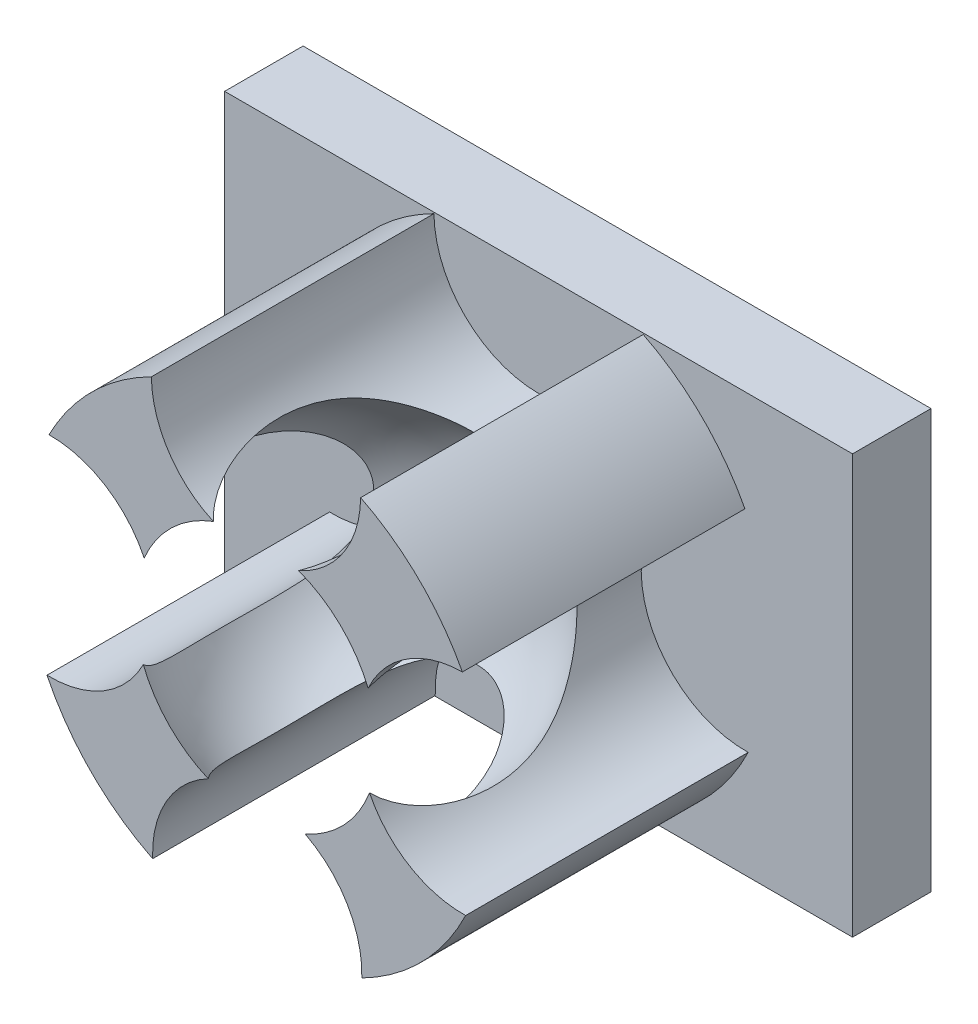
from build123d import *

# Parameters (mm, degrees)
SKIZZE1_W                       = 24
SKIZZE1_H                       = 16
AUFSATZ_LINEAR_AUSTRAGEN1_DEPTH = 3
AUFSATZ_LINEAR_AUSTRAGEN2_DEPTH = 10.8


with BuildPart() as part:
    # Skizze1 → Aufsatz-Linear austragen1 (new body)
    with BuildSketch(Plane.XY):
        Rectangle(SKIZZE1_W, SKIZZE1_H)
    extrude(amount=AUFSATZ_LINEAR_AUSTRAGEN1_DEPTH)

    # Skizze2 → Aufsatz-Linear austragen2 (add)
    with BuildSketch(Plane.XY.offset(3)):
        with BuildLine():
            ThreePointArc((-3.999695252, 7.950625), (-6.26249607, 6.323855072), (-7.911250653, 4.077022578))
            ThreePointArc((-7.911250653, 4.077022578), (-3.876728126, 0.037983649), (-7.989616413, -3.92122807))
            ThreePointArc((-7.989616413, -3.92122807), (-6.304514257, -6.281966252), (-3.949828748, -7.975515837))
            ThreePointArc((-3.949828748, -7.975515837), (0.022550329, -3.799433377), (4.044219423, -7.928069706))
            ThreePointArc((4.044219423, -7.928069706), (6.359488738, -6.226307332), (8.011875714, -3.875544807))
            ThreePointArc((8.011875714, -3.875544807), (3.923312373, 0.061138188), (7.88722716, 4.123305437))
            ThreePointArc((7.88722716, 4.123305437), (6.243943055, 6.342174322), (3.999695252, 7.950625))
            ThreePointArc((3.999695252, 7.950625), (0, 4), (-3.999695252, 7.950625))
        make_face()
    extrude(amount=AUFSATZ_LINEAR_AUSTRAGEN2_DEPTH)

    # Skizze3 → Schnitt-Rotation1 (revolve, cut)
    with BuildSketch(Plane(origin=(0, 0, 0), x_dir=(1, 0, 0), z_dir=(0, 1, 0))):
        with BuildLine():
            Line((0, -4), (0, -16))
            ThreePointArc((0, -16), (6, -10), (0, -4))
        make_face()
    revolve(axis=Axis((0, 0, 4), (0, 0, 1)), mode=Mode.SUBTRACT)


solid = part.part
